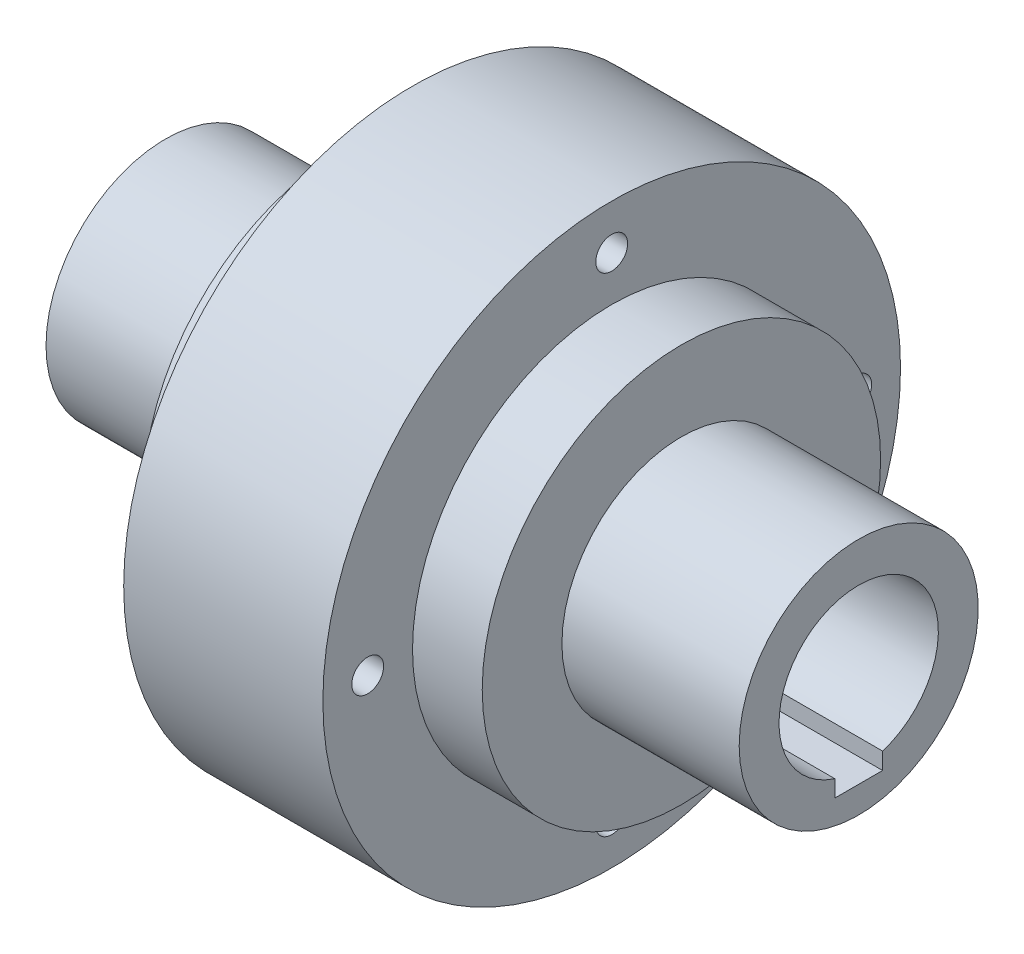
from build123d import *

# Parameters (mm, degrees)
SKETCH_2_R               = 4
CUT_EXTRUDE_1_DEPTH      = 152.843669608
PATTERN_CIRCULAR_1_COUNT = 4
SKETCH_4_W               = 12
SKETCH_4_H               = 23.3
CUT_EXTRUDE_2_DEPTH      = 202.961630019


with BuildPart() as part:
    # Эскиз1 → Повернуть1 (revolve)
    with BuildSketch(Plane.XY, mode=Mode.PRIVATE) as revolve_1_sk:
        Polygon((-5, 20), (-5, 30), (-41.5, 30), (-41.5, 40.016205048), (41.5, 40.016205048), (41.5, 30), (5, 30), (5, 20), (87, 20), (87, 30), (42.5, 30), (42.5, 50), (25, 50), (25, 72.5), (-25, 72.5), (-25, 50), (-42.5, 50), (-42.5, 30), (-87, 30), (-87, 20), align=None)
    revolve(revolve_1_sk.sketch.rotate(Axis((-171.104100946, 0, 0), (1, 0, 0)), 90), axis=Axis((-171.104100946, 0, 0), (1, 0, 0)))

    # Эскиз2 → Вырез-Вытянуть1 (cut, through all)
    with BuildSketch(Plane(origin=(25, 0, 0), x_dir=(0, 0, -1), z_dir=(1, 0, 0))):
        with Locations((0, 61.25)):
            Circle(SKETCH_2_R)
    cut_extrude_1 = extrude(amount=-CUT_EXTRUDE_1_DEPTH, mode=Mode.SUBTRACT)

    # Круговой массив1: Вырез-Вытянуть1 ×4 about axis
    pattern_circular_1_axis = Axis((0, 0, 0), (1, 0, 0))
    for i in range(1, PATTERN_CIRCULAR_1_COUNT):
        add(cut_extrude_1.rotate(pattern_circular_1_axis, i * 360 / PATTERN_CIRCULAR_1_COUNT), mode=Mode.SUBTRACT)

    # Эскиз4 → Вырез-Вытянуть2 (cut, through all)
    with BuildSketch(Plane.ZY.offset(87)):
        with Locations((0, -11.65)):
            Rectangle(SKETCH_4_W, SKETCH_4_H)
    extrude(amount=-CUT_EXTRUDE_2_DEPTH, mode=Mode.SUBTRACT)


solid = part.part
